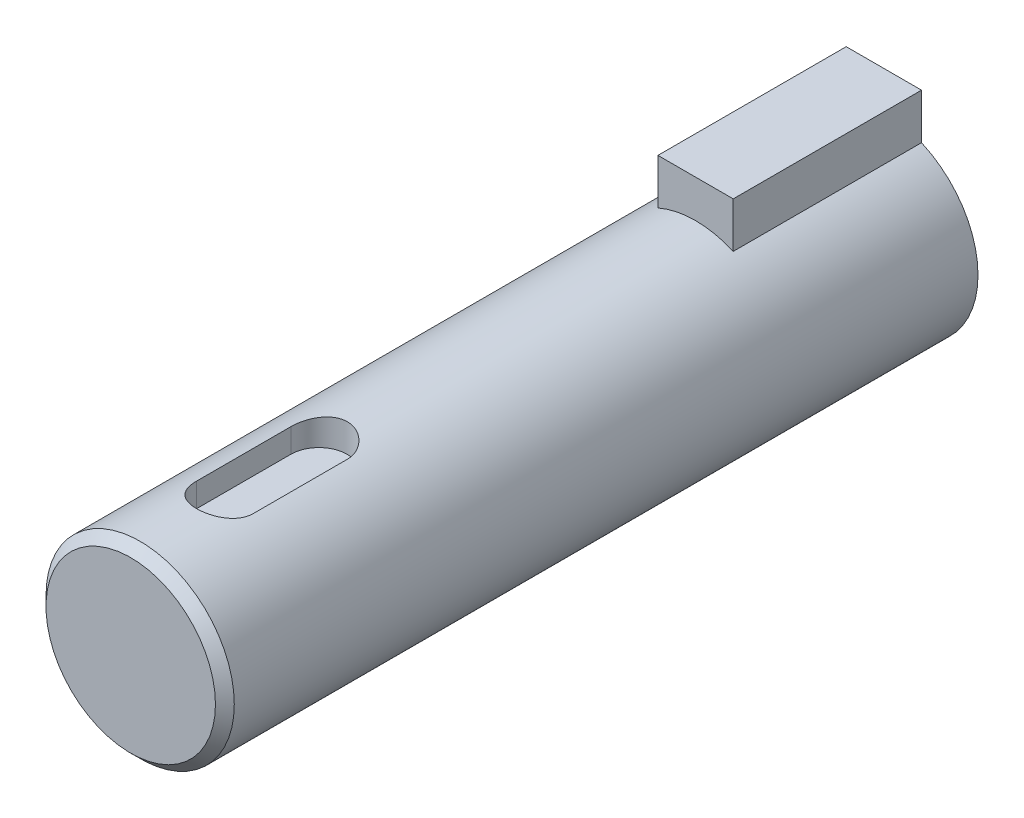
from build123d import *

# Parameters (mm, degrees)
BOSS_EXTRUDE1_DEPTH = 10
SKETCH2_R           = 5
BOSS_EXTRUDE2_DEPTH = 30
CUT_EXTRUDE1_START  = 3.5
CUT_EXTRUDE1_DEPTH  = 38.414545091
CHAMFER1_SIZE       = 0.5


with BuildPart() as part:
    # Sketch1 → Boss-Extrude1 (new body)
    with BuildSketch(Plane.XY):
        with BuildLine():
            Line((-2, 4.582575695), (-2, 7))
            Line((-2, 7), (2, 7))
            Line((2, 7), (2, 4.582575695))
            ThreePointArc((2, 4.582575695), (0, -5), (-2, 4.582575695))
        make_face()
    extrude(amount=BOSS_EXTRUDE1_DEPTH)

    # Sketch2 → Boss-Extrude2 (add)
    with BuildSketch(Plane.XY.offset(10)):
        with Locations(Location((0, 0, 0), (0, 0, 113.578178478))):
            Circle(SKETCH2_R)
    extrude(amount=BOSS_EXTRUDE2_DEPTH)

    # Sketch3 → Cut-Extrude1 (cut, through all)
    with BuildSketch(Plane(origin=(0, 0, 0), x_dir=(1, 0, 0), z_dir=(0, 1, 0)).offset(CUT_EXTRUDE1_START)):
        with BuildLine():
            Line((-1.5, -35), (-1.5, -30))
            ThreePointArc((-1.5, -30), (0, -28.5), (1.5, -30))
            Line((1.5, -30), (1.5, -35))
            ThreePointArc((1.5, -35), (0, -36.5), (-1.5, -35))
        make_face()
    extrude(amount=CUT_EXTRUDE1_DEPTH, mode=Mode.SUBTRACT)

    # Chamfer1
    chamfer1_edges = [part.edges().sort_by_distance(p)[0] for p in [
        (2, -4.582575695, 40),
    ]]
    chamfer(chamfer1_edges, length=CHAMFER1_SIZE)


solid = part.part
